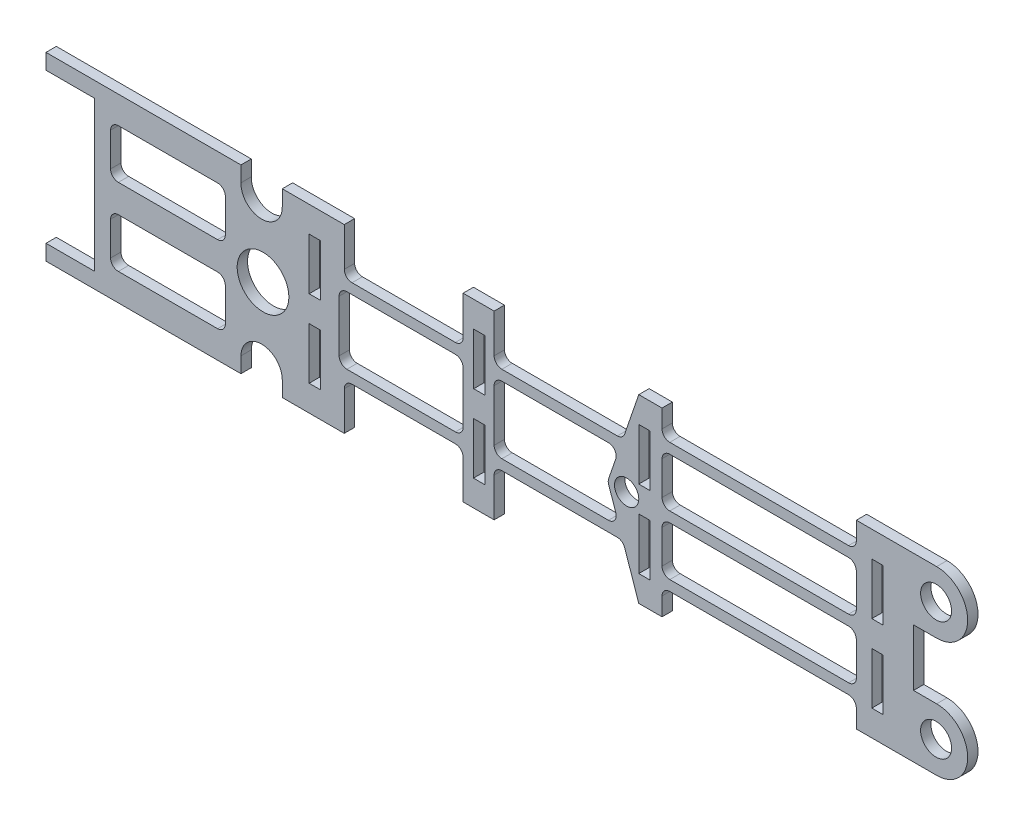
from build123d import *

# Parameters (mm, degrees)
MODEL_R         = 3
MODEL_R_2       = 2.35
MODEL_R_3       = 5
MODEL_W         = 2.2
MODEL_H         = 10
EXTRUDE_1_DEPTH = 2


with BuildPart() as part:
    # Model → 凸台-拉伸1 (new body)
    with BuildSketch(Plane.XY):
        with BuildLine():
            Line((42.207834759, 34.585721775), (42.207834759, 37.585721775))
            Line((42.207834759, 37.585721775), (4.478222617, 37.585721775))
            Line((4.478222617, 37.585721775), (4.478222617, 34.585721775))
            Line((4.478222617, 34.585721775), (13.878222617, 34.585721775))
            Line((13.878222617, 34.585721775), (13.878222617, 5.585721775))
            Line((13.878222617, 5.585721775), (4.478222617, 5.585721775))
            Line((4.478222617, 5.585721775), (4.478222617, 2.585721775))
            Line((4.478222617, 2.585721775), (42.207834759, 2.585721775))
            Line((42.207834759, 2.585721775), (42.207834759, 5.585721775))
            ThreePointArc((42.207834759, 5.585721775), (46.241179833, 9.551811246), (50.207269305, 5.518466173))
            Line((50.207269305, 5.518466173), (50.205774509, 2.585721775))
            Line((50.205774509, 2.585721775), (62.206804634, 2.585721775))
            Line((62.206804634, 2.585721775), (62.206804634, 10.085721775))
            ThreePointArc((62.206804634, 10.085721775), (62.646144463, 11.146381946), (63.706804634, 11.585721775))
            Line((63.706804634, 11.585721775), (83.706804634, 11.585721775))
            ThreePointArc((83.706804634, 11.585721775), (84.767464806, 11.146381946), (85.206804634, 10.085721775))
            Line((85.206804634, 10.085721775), (85.206804634, 2.585721775))
            Line((85.206804634, 2.585721775), (91.206804634, 2.585721775))
            Line((91.206804634, 2.585721775), (91.206804634, 10.085721775))
            ThreePointArc((91.206804634, 10.085721775), (91.646144463, 11.146381946), (92.706804634, 11.585721775))
            Line((92.706804634, 11.585721775), (115.049506416, 11.585721775))
            ThreePointArc((115.049506416, 11.585721775), (115.921363706, 11.306321981), (116.468425335, 10.572208261))
            Line((116.468425335, 10.572208261), (119.206649273, 2.585721775))
            Line((119.206649273, 2.585721775), (123.706021861, 2.585721775))
            Line((123.706021861, 2.585721775), (123.706021861, 6.085721775))
            ThreePointArc((123.706021861, 6.085721775), (124.145361689, 7.146381946), (125.206021861, 7.585721775))
            Line((125.206021861, 7.585721775), (159.806021861, 7.585721775))
            ThreePointArc((159.806021861, 7.585721775), (160.866682033, 7.146381946), (161.306021861, 6.085721775))
            Line((161.306021861, 6.085721775), (161.306021861, 2.585721775))
            Line((161.306021861, 2.585721775), (176.857875106, 2.585721775))
            ThreePointArc((176.857875106, 2.585721775), (182.857875106, 8.585721775), (176.857875106, 14.585721775))
            Line((176.857875106, 14.585721775), (172.375964349, 14.585721775))
            Line((172.375964349, 14.585721775), (172.375964349, 25.585721775))
            Line((172.375964349, 25.585721775), (176.857875106, 25.585721775))
            ThreePointArc((176.857875106, 25.585721775), (182.857875106, 31.585721775), (176.857875106, 37.585721775))
            Line((176.857875106, 37.585721775), (161.306021861, 37.585721775))
            Line((161.306021861, 37.585721775), (161.306021861, 34.085721775))
            ThreePointArc((161.306021861, 34.085721775), (160.866682033, 33.025061603), (159.806021861, 32.585721775))
            Line((159.806021861, 32.585721775), (125.206021861, 32.585721775))
            ThreePointArc((125.206021861, 32.585721775), (124.145361689, 33.025061603), (123.706021861, 34.085721775))
            Line((123.706021861, 34.085721775), (123.706021861, 37.585721775))
            Line((123.706021861, 37.585721775), (119.206649273, 37.585721775))
            Line((119.206649273, 37.585721775), (116.468425335, 29.599235288))
            ThreePointArc((116.468425335, 29.599235288), (115.921363706, 28.865121568), (115.049506416, 28.585721775))
            Line((115.049506416, 28.585721775), (92.706804634, 28.585721775))
            ThreePointArc((92.706804634, 28.585721775), (91.646144463, 29.025061603), (91.206804634, 30.085721775))
            Line((91.206804634, 30.085721775), (91.206804634, 37.585721775))
            Line((91.206804634, 37.585721775), (85.206804634, 37.585721775))
            Line((85.206804634, 37.585721775), (85.206804634, 30.085721775))
            ThreePointArc((85.206804634, 30.085721775), (84.767464806, 29.025061603), (83.706804634, 28.585721775))
            Line((83.706804634, 28.585721775), (63.706804634, 28.585721775))
            ThreePointArc((63.706804634, 28.585721775), (62.646144463, 29.025061603), (62.206804634, 30.085721775))
            Line((62.206804634, 30.085721775), (62.206804634, 37.585721775))
            Line((62.206804634, 37.585721775), (50.205774509, 37.585721775))
            Line((50.205774509, 37.585721775), (50.205774509, 34.585721775))
            ThreePointArc((50.205774509, 34.585721775), (46.206804634, 30.501548086), (42.207834759, 34.585721775))
        make_face()
        with Locations((176.745324773, 8.585721775)):
            Circle(MODEL_R, mode=Mode.SUBTRACT)
        with Locations((176.745324773, 31.585721775)):
            Circle(MODEL_R, mode=Mode.SUBTRACT)
        with Locations((116.856649273, 20.085721775)):
            Circle(MODEL_R_2, mode=Mode.SUBTRACT)
        with Locations((46.479868031, 20.085721775)):
            Circle(MODEL_R_3, mode=Mode.SUBTRACT)
        with BuildLine():
            Line((161.306021861, 22.585721775), (161.306021861, 29.085721775))
            ThreePointArc((161.306021861, 29.085721775), (160.866682033, 30.146381946), (159.806021861, 30.585721775))
            Line((159.806021861, 30.585721775), (125.206021861, 30.585721775))
            ThreePointArc((125.206021861, 30.585721775), (124.145361689, 30.146381946), (123.706021861, 29.085721775))
            Line((123.706021861, 29.085721775), (123.706021861, 22.585721775))
            ThreePointArc((123.706021861, 22.585721775), (124.145361689, 21.525061603), (125.206021861, 21.085721775))
            Line((125.206021861, 21.085721775), (159.806021861, 21.085721775))
            ThreePointArc((159.806021861, 21.085721775), (160.866682033, 21.525061603), (161.306021861, 22.585721775))
        make_face(mode=Mode.SUBTRACT)
        with BuildLine():
            Line((123.706021861, 17.585721775), (123.706021861, 11.085721775))
            ThreePointArc((123.706021861, 11.085721775), (124.145361689, 10.025061603), (125.206021861, 9.585721775))
            Line((125.206021861, 9.585721775), (159.806021861, 9.585721775))
            ThreePointArc((159.806021861, 9.585721775), (160.866682033, 10.025061603), (161.306021861, 11.085721775))
            Line((161.306021861, 11.085721775), (161.306021861, 17.585721775))
            ThreePointArc((161.306021861, 17.585721775), (160.866682033, 18.646381946), (159.806021861, 19.085721775))
            Line((159.806021861, 19.085721775), (125.206021861, 19.085721775))
            ThreePointArc((125.206021861, 19.085721775), (124.145361689, 18.646381946), (123.706021861, 17.585721775))
        make_face(mode=Mode.SUBTRACT)
        with Locations((56.506804634, 12.585721775)):
            Rectangle(MODEL_W, MODEL_H, mode=Mode.SUBTRACT)
        with Locations((56.506804634, 27.585721775)):
            Rectangle(MODEL_W, MODEL_H, mode=Mode.SUBTRACT)
        with Locations((165.406021861, 12.585721775)):
            Rectangle(MODEL_W, MODEL_H, mode=Mode.SUBTRACT)
        with Locations((165.406021861, 27.585721775)):
            Rectangle(MODEL_W, MODEL_H, mode=Mode.SUBTRACT)
        with Locations((120.306649273, 12.585721775)):
            Rectangle(MODEL_W, MODEL_H, mode=Mode.SUBTRACT)
        with Locations((120.306649273, 27.585721775)):
            Rectangle(MODEL_W, MODEL_H, mode=Mode.SUBTRACT)
        Polygon((87.206804634, 7.585721775), (89.406804634, 7.585721775), (89.406791039, 17.583389823), (87.206804634, 17.585721775), align=None, mode=Mode.SUBTRACT)
        Polygon((87.253377966, 32.591005683), (89.453377966, 32.591005683), (89.406734823, 22.591005683), (87.253377966, 22.591005683), align=None, mode=Mode.SUBTRACT)
        with BuildLine():
            Line((62.706804634, 13.585721775), (83.706804634, 13.585721775))
            ThreePointArc((83.706804634, 13.585721775), (84.767464806, 14.025061603), (85.206804634, 15.085721775))
            Line((85.206804634, 15.085721775), (85.206804634, 25.085721775))
            ThreePointArc((85.206804634, 25.085721775), (84.767464806, 26.146381946), (83.706804634, 26.585721775))
            Line((83.706804634, 26.585721775), (62.706804634, 26.585721775))
            ThreePointArc((62.706804634, 26.585721775), (61.646144463, 26.146381946), (61.206804634, 25.085721775))
            Line((61.206804634, 25.085721775), (61.206804634, 15.085721775))
            ThreePointArc((61.206804634, 15.085721775), (61.646144463, 14.025061603), (62.706804634, 13.585721775))
        make_face(mode=Mode.SUBTRACT)
        with BuildLine():
            Line((113.335220701, 26.585721775), (92.706804634, 26.585721775))
            ThreePointArc((92.706804634, 26.585721775), (91.646144463, 26.146381946), (91.206804634, 25.085721775))
            Line((91.206804634, 25.085721775), (91.206804634, 15.085721775))
            ThreePointArc((91.206804634, 15.085721775), (91.646144463, 14.025061603), (92.706804634, 13.585721775))
            Line((92.706804634, 13.585721775), (113.335220701, 13.585721775))
            ThreePointArc((113.335220701, 13.585721775), (114.555820908, 14.213864484), (114.75413962, 15.572208261))
            Line((114.75413962, 15.572208261), (113.37344464, 19.599235288))
            ThreePointArc((113.37344464, 19.599235288), (113.292363558, 20.085721775), (113.37344464, 20.572208261))
            Line((113.37344464, 20.572208261), (114.75413962, 24.599235288))
            ThreePointArc((114.75413962, 24.599235288), (114.555820908, 25.957579065), (113.335220701, 26.585721775))
        make_face(mode=Mode.SUBTRACT)
        with BuildLine():
            Line((18.477950078, 22.799320708), (37.681937895, 22.799320708))
            ThreePointArc((37.681937895, 22.799320708), (38.742598067, 23.238660536), (39.181937895, 24.299320708))
            Line((39.181937895, 24.299320708), (39.181937895, 30.799320708))
            ThreePointArc((39.181937895, 30.799320708), (38.742598067, 31.859980879), (37.681937895, 32.299320708))
            Line((37.681937895, 32.299320708), (18.477950078, 32.299320708))
            ThreePointArc((18.477950078, 32.299320708), (17.417289906, 31.859980879), (16.977950078, 30.799320708))
            Line((16.977950078, 30.799320708), (16.977950078, 24.299320708))
            ThreePointArc((16.977950078, 24.299320708), (17.417289906, 23.238660536), (18.477950078, 22.799320708))
        make_face(mode=Mode.SUBTRACT)
        with BuildLine():
            Line((18.477950078, 17.372122842), (37.681937895, 17.372122842))
            ThreePointArc((37.681937895, 17.372122842), (38.742598067, 16.932783014), (39.181937895, 15.872122842))
            Line((39.181937895, 15.872122842), (39.181937895, 9.372122842))
            ThreePointArc((39.181937895, 9.372122842), (38.742598067, 8.31146267), (37.681937895, 7.872122842))
            Line((37.681937895, 7.872122842), (18.477950078, 7.872122842))
            ThreePointArc((18.477950078, 7.872122842), (17.417289906, 8.31146267), (16.977950078, 9.372122842))
            Line((16.977950078, 9.372122842), (16.977950078, 15.872122842))
            ThreePointArc((16.977950078, 15.872122842), (17.417289906, 16.932783014), (18.477950078, 17.372122842))
        make_face(mode=Mode.SUBTRACT)
    extrude(amount=EXTRUDE_1_DEPTH)


solid = part.part
